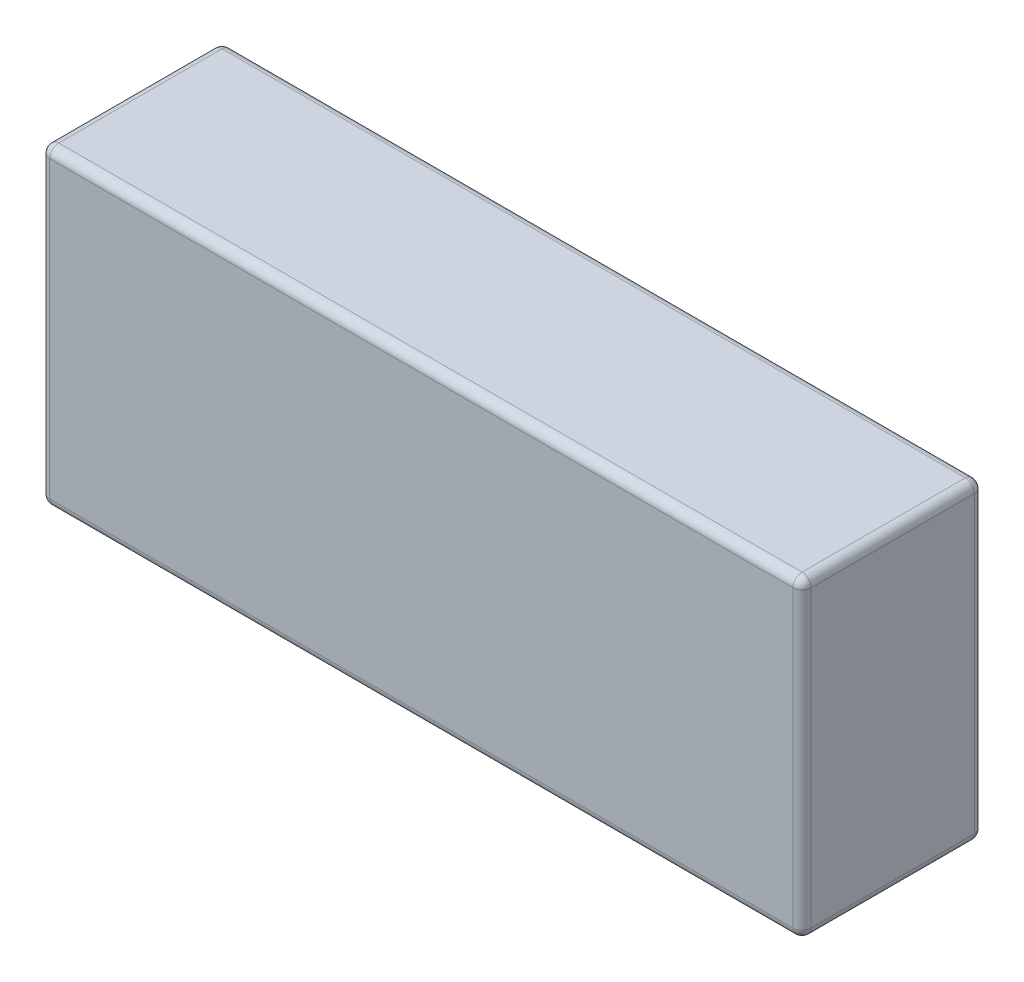
from build123d import *

# Parameters (mm, degrees)
SKETCH1_W           = 168
SKETCH1_H           = 40
BOSS_EXTRUDE1_DEPTH = 69
FILLET1_R           = 2


with BuildPart() as part:
    # Sketch1 → Boss-Extrude1 (new body)
    with BuildSketch(Plane(origin=(0, 0, 0), x_dir=(1, 0, 0), z_dir=(0, 1, 0))):
        with Locations((84, -20)):
            Rectangle(SKETCH1_W, SKETCH1_H)
    extrude(amount=BOSS_EXTRUDE1_DEPTH)

    # Fillet1
    fillet1_edges = [part.edges().sort_by_distance(p)[0] for p in [
        (84, 69, 40),
        (168, 69, 20),
        (84, 69, 0),
        (168, 0, 20),
        (84, 0, 40),
        (0, 0, 20),
        (84, 0, 0),
        (168, 34.5, 0),
        (168, 34.5, 40),
        (0, 34.5, 40),
        (0, 34.5, 0),
        (0, 69, 20),
    ]]
    fillet(fillet1_edges, radius=FILLET1_R)


solid = part.part
